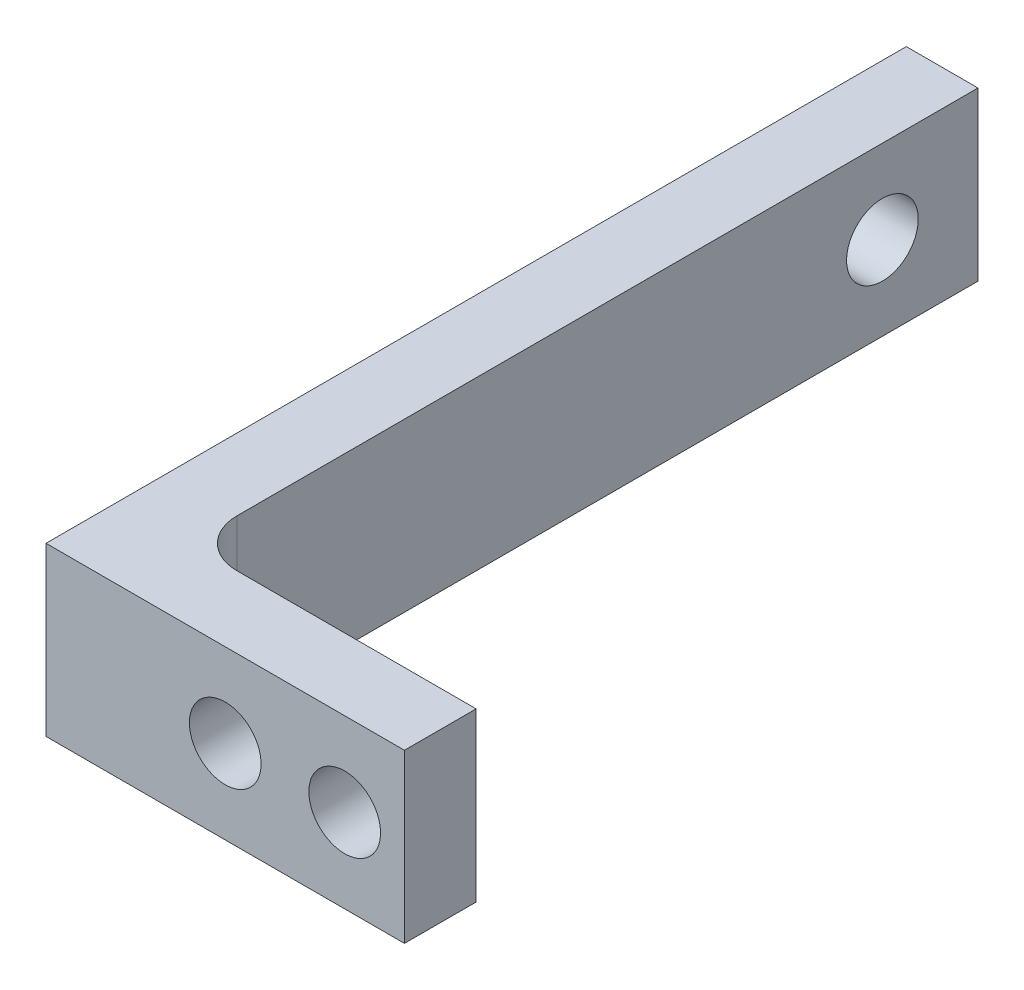
from build123d import *

# Parameters (mm, degrees)
BOSS_EXTRUDE1_DEPTH = 7
FILLET1_R           = 2
SKETCH2_R           = 1.5
CUT_EXTRUDE1_DEPTH  = 7
SKETCH3_W           = 5
SKETCH3_H           = 7
BOSS_EXTRUDE2_DEPTH = 3
SKETCH4_R           = 1.5
CUT_EXTRUDE2_DEPTH  = 3
SKETCH5_R           = 1.5
CUT_EXTRUDE3_DEPTH  = 3


with BuildPart() as part:
    # Sketch1 → Boss-Extrude1 (new body)
    with BuildSketch(Plane(origin=(0, 0, 0), x_dir=(1, 0, 0), z_dir=(0, 1, 0))):
        Polygon((0, 0), (10, 0), (10, 3), (3, 3), (3, 36), (0, 36), align=None)
    extrude(amount=BOSS_EXTRUDE1_DEPTH)

    # Fillet1
    fillet1_edges = [part.edges().sort_by_distance(p)[0] for p in [
        (3, 3.5, -3),
    ]]
    fillet(fillet1_edges, radius=FILLET1_R)

    # Sketch2 → Cut-Extrude1 (cut)
    with BuildSketch(Plane(origin=(0, 0, -3), x_dir=(-1, 0, 0), z_dir=(0, 0, -1))):
        with Locations((-7.5, 3.5)):
            Circle(SKETCH2_R)
    extrude(amount=-CUT_EXTRUDE1_DEPTH, mode=Mode.SUBTRACT)

    # Sketch3 → Boss-Extrude2 (add)
    with BuildSketch(Plane.XY):
        with Locations((12.5, 3.5)):
            Rectangle(SKETCH3_W, SKETCH3_H)
    extrude(amount=-BOSS_EXTRUDE2_DEPTH)

    # Sketch4 → Cut-Extrude2 (cut)
    with BuildSketch(Plane(origin=(0, 0, -3), x_dir=(-1, 0, 0), z_dir=(0, 0, -1))):
        with Locations((-12.5, 3.5)):
            Circle(SKETCH4_R)
    extrude(amount=-CUT_EXTRUDE2_DEPTH, mode=Mode.SUBTRACT)

    # Sketch5 → Cut-Extrude3 (cut)
    with BuildSketch(Plane.ZY):
        with Locations((-32, 3.5)):
            Circle(SKETCH5_R)
    extrude(amount=-CUT_EXTRUDE3_DEPTH, mode=Mode.SUBTRACT)


solid = part.part
